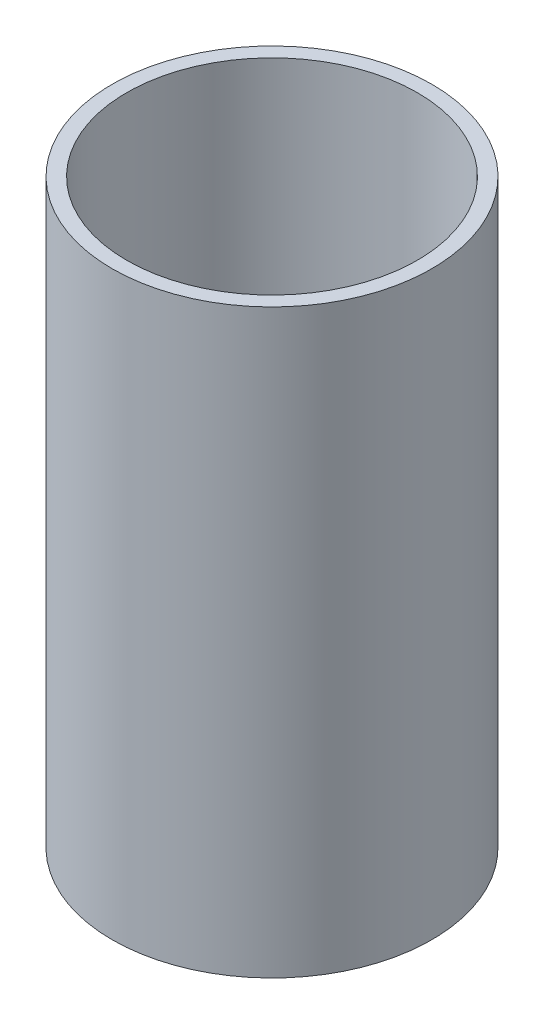
from build123d import *

# Parameters (mm, degrees)
SKETCH1_R      = 27.94
SKETCH1_R_2    = 25.4
EXTRUDE1_DEPTH = 101.6


with BuildPart() as part:
    # Sketch1 → Extrude1 (new body)
    with BuildSketch(Plane(origin=(0, 0, 0), x_dir=(1, 0, 0), z_dir=(0, 1, 0))):
        with Locations(Location((0, 0, 0), (0, 0, 270))):
            Circle(SKETCH1_R)
        with Locations(Location((0, 0, 0), (0, 0, 270))):
            Circle(SKETCH1_R_2, mode=Mode.SUBTRACT)
    extrude(amount=EXTRUDE1_DEPTH)


solid = part.part
